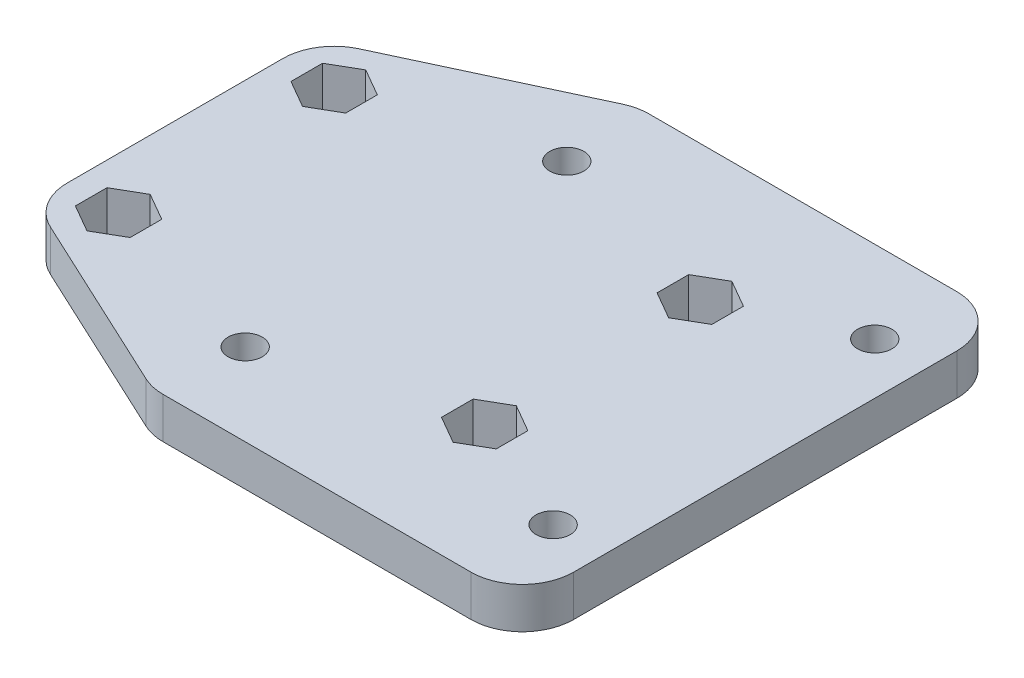
from build123d import *

# Parameters (mm, degrees)
SKETCH1_R               = 7.5
SKETCH1_R_2             = 2.75
SKETCH1_R_3             = 2.5
BOSS_EXTRUDE1_DEPTH     = 6
CUT_EXTRUDE1_DEPTH      = 70.758959998
CUT_EXTRUDE1_DEPTH_BACK = 70.758959998


with BuildPart() as part:
    # Sketch1 → Boss-Extrude1 (new body)
    # profile 1 of 7: a face of its own
    with BuildSketch(Plane(origin=(0, 0, 0), x_dir=(1, 0, 0), z_dir=(0, 1, 0))):
        with Locations((-52.25, 15.75)):
            Circle(SKETCH1_R)
        with Locations(Location((-52.25, 15.75, 0), (0, 0, 270))):
            Circle(SKETCH1_R_2, mode=Mode.SUBTRACT)
    # profile 2 of 7: a face of its own
    with BuildSketch(Plane(origin=(0, 0, 0), x_dir=(1, 0, 0), z_dir=(0, 1, 0))):
        with BuildLine():
            ThreePointArc((-44.75, 15.75), (-52.25, 8.25), (-59.75, 15.75))
            Line((-59.75, 15.75), (-59.75, -15.75))
            ThreePointArc((-59.75, -15.75), (-52.25, -8.25), (-44.75, -15.75))
            ThreePointArc((-44.75, -15.75), (-48.221185498, -22.076029854), (-55.42164099, -22.54637355))
            Line((-55.42164099, -22.54637355), (-29.17164099, -34.79637355))
            ThreePointArc((-29.17164099, -34.79637355), (-30.028814502, -21.673970146), (-18.5, -28))
            ThreePointArc((-18.5, -28), (-20.696699141, -33.303300859), (-26, -35.5))
            Line((-26, -35.5), (19, -35.5))
            ThreePointArc((19, -35.5), (13.696699141, -22.696699141), (26.5, -28))
            Line((26.5, -28), (26.5, 28))
            ThreePointArc((26.5, 28), (13.696699141, 22.696699141), (19, 35.5))
            Line((19, 35.5), (-26, 35.5))
            ThreePointArc((-26, 35.5), (-20.696699141, 33.303300859), (-18.5, 28))
            ThreePointArc((-18.5, 28), (-30.028814502, 21.673970146), (-29.17164099, 34.79637355))
            Line((-29.17164099, 34.79637355), (-55.42164099, 22.54637355))
            ThreePointArc((-55.42164099, 22.54637355), (-48.221185498, 22.076029854), (-44.75, 15.75))
        make_face()
        with Locations(Location((1.25, -15.75, 0), (0, 0, 270))):
            Circle(SKETCH1_R_2, mode=Mode.SUBTRACT)
        with Locations(Location((1.25, 15.75, 0), (0, 0, 270))):
            Circle(SKETCH1_R_2, mode=Mode.SUBTRACT)
    # profile 3 of 7: a face of its own
    with BuildSketch(Plane(origin=(0, 0, 0), x_dir=(1, 0, 0), z_dir=(0, 1, 0))):
        with Locations((-52.25, -15.75)):
            Circle(SKETCH1_R)
        with Locations(Location((-52.25, -15.75, 0), (0, 0, 270))):
            Circle(SKETCH1_R_2, mode=Mode.SUBTRACT)
    # profile 4 of 7: a face of its own
    with BuildSketch(Plane(origin=(0, 0, 0), x_dir=(1, 0, 0), z_dir=(0, 1, 0))):
        with Locations((-26, -28)):
            Circle(SKETCH1_R)
        with Locations(Location((-26, -23.5, 0), (0, 0, 270))):
            Circle(SKETCH1_R_3, mode=Mode.SUBTRACT)
    # profile 5 of 7: a face of its own
    with BuildSketch(Plane(origin=(0, 0, 0), x_dir=(1, 0, 0), z_dir=(0, 1, 0))):
        with Locations((19, -28)):
            Circle(SKETCH1_R)
        with Locations(Location((19, -23.5, 0), (0, 0, 270))):
            Circle(SKETCH1_R_3, mode=Mode.SUBTRACT)
    # profile 6 of 7: a face of its own
    with BuildSketch(Plane(origin=(0, 0, 0), x_dir=(1, 0, 0), z_dir=(0, 1, 0))):
        with Locations((19, 28)):
            Circle(SKETCH1_R)
        with Locations(Location((19, 23.5, 0), (0, 0, 270))):
            Circle(SKETCH1_R_3, mode=Mode.SUBTRACT)
    # profile 7 of 7: a face of its own
    with BuildSketch(Plane(origin=(0, 0, 0), x_dir=(1, 0, 0), z_dir=(0, 1, 0))):
        with Locations((-26, 28)):
            Circle(SKETCH1_R)
        with Locations(Location((-26, 23.5, 0), (0, 0, 270))):
            Circle(SKETCH1_R_3, mode=Mode.SUBTRACT)
    extrude(amount=BOSS_EXTRUDE1_DEPTH)

    # Sketch2 → Cut-Extrude1 (cut, two sides: drawn at the far end of the back side and taken through both)
    with BuildSketch(Plane(origin=(0, 6, 0), x_dir=(1, 0, 0), z_dir=(0, 1, 0)).offset(-CUT_EXTRUDE1_DEPTH_BACK)):
        Polygon((-52.25, 11.131197846), (-48.25, 13.440598923), (-48.25, 18.059401077), (-52.25, 20.368802154), (-56.25, 18.059401077), (-56.25, 13.440598923), align=None)
        Polygon((-52.25, -11.131197846), (-56.25, -13.440598923), (-56.25, -18.059401077), (-52.25, -20.368802154), (-48.25, -18.059401077), (-48.25, -13.440598923), align=None)
        Polygon((-2.75, -18.059401077), (1.25, -20.368802154), (5.25, -18.059401077), (5.25, -13.440598923), (1.25, -11.131197846), (-2.75, -13.440598923), align=None)
        Polygon((1.25, 11.131197846), (5.25, 13.440598923), (5.25, 18.059401077), (1.25, 20.368802154), (-2.75, 18.059401077), (-2.75, 13.440598923), align=None)
    extrude(amount=CUT_EXTRUDE1_DEPTH + CUT_EXTRUDE1_DEPTH_BACK, mode=Mode.SUBTRACT)


solid = part.part
